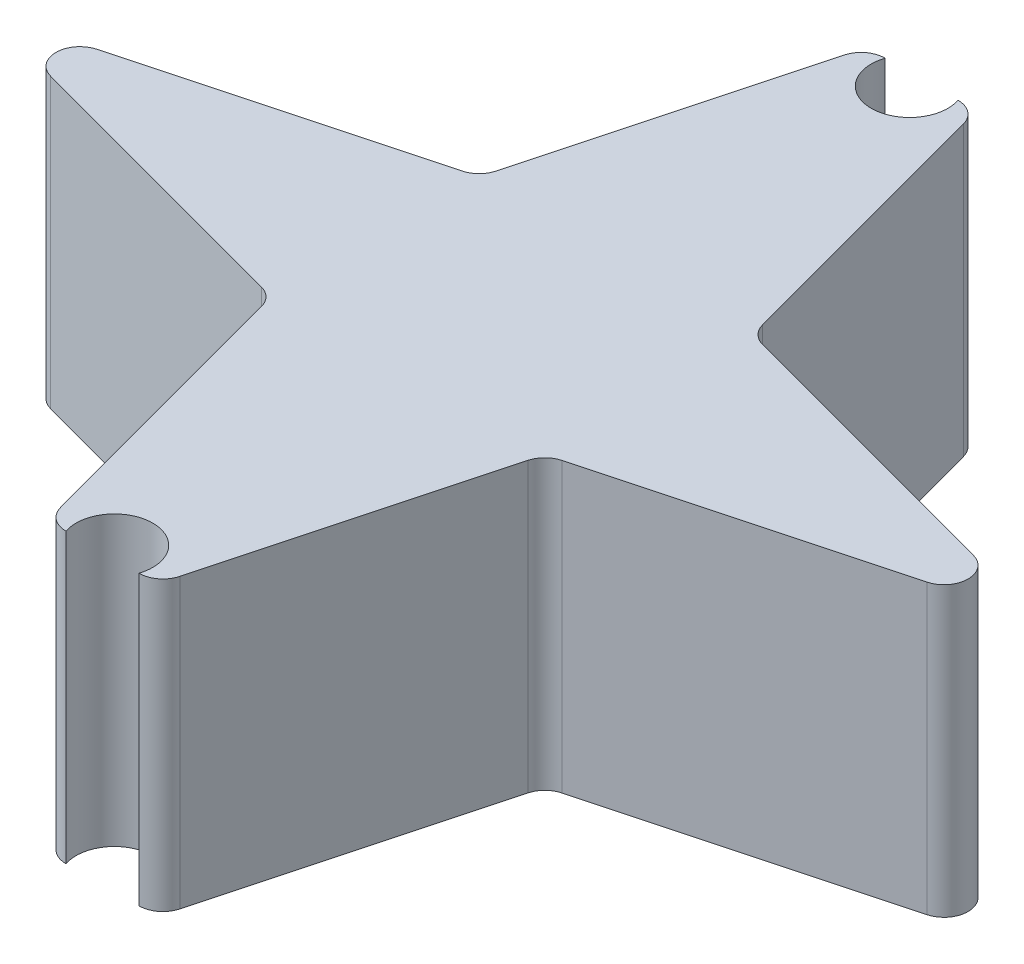
from build123d import *

# Parameters (mm, degrees)
BOSS_EXTRU_1_DEPTH = 12


with BuildPart() as part:
    # Esquisse1 → Boss.-Extru.1 (new body)
    with BuildSketch(Plane(origin=(0, 0, 0), x_dir=(1, 0, 0), z_dir=(0, 1, 0))):
        with BuildLine():
            Line((2.485794242, 16.322649508), (5.549421558, 4.88903671))
            ThreePointArc((5.549421558, 4.88903671), (5.808240603, 4.440748973), (6.256528339, 4.181929928))
            Line((6.256528339, 4.181929928), (18.258819045, 0.965925826))
            ThreePointArc((18.258819045, 0.965925826), (19, 0), (18.258819045, -0.965925826))
            Line((18.258819045, -0.965925826), (6.256528339, -4.181929928))
            ThreePointArc((6.256528339, -4.181929928), (5.808240603, -4.440748973), (5.549421558, -4.88903671))
            Line((5.549421558, -4.88903671), (2.485794242, -16.322649508))
            ThreePointArc((2.485794242, -16.322649508), (2.128629844, -16.857183803), (1.519868415, -17.063830463))
            ThreePointArc((1.519868415, -17.063830463), (0, -14.963830463), (-1.519868415, -17.063830463))
            ThreePointArc((-1.519868415, -17.063830463), (-2.128629844, -16.857183803), (-2.485794242, -16.322649508))
            Line((-2.485794242, -16.322649508), (-5.549421558, -4.88903671))
            ThreePointArc((-5.549421558, -4.88903671), (-5.808240603, -4.440748973), (-6.256528339, -4.181929928))
            Line((-6.256528339, -4.181929928), (-18.258819045, -0.965925826))
            ThreePointArc((-18.258819045, -0.965925826), (-19, 0), (-18.258819045, 0.965925826))
            Line((-18.258819045, 0.965925826), (-6.256528339, 4.181929928))
            ThreePointArc((-6.256528339, 4.181929928), (-5.808240603, 4.440748973), (-5.549421558, 4.88903671))
            Line((-5.549421558, 4.88903671), (-2.485794242, 16.322649508))
            ThreePointArc((-2.485794242, 16.322649508), (-2.128629844, 16.857183803), (-1.519868415, 17.063830463))
            ThreePointArc((-1.519868415, 17.063830463), (0, 14.963830463), (1.519868415, 17.063830463))
            ThreePointArc((1.519868415, 17.063830463), (2.128629844, 16.857183803), (2.485794242, 16.322649508))
        make_face()
    extrude(amount=BOSS_EXTRU_1_DEPTH)


solid = part.part
